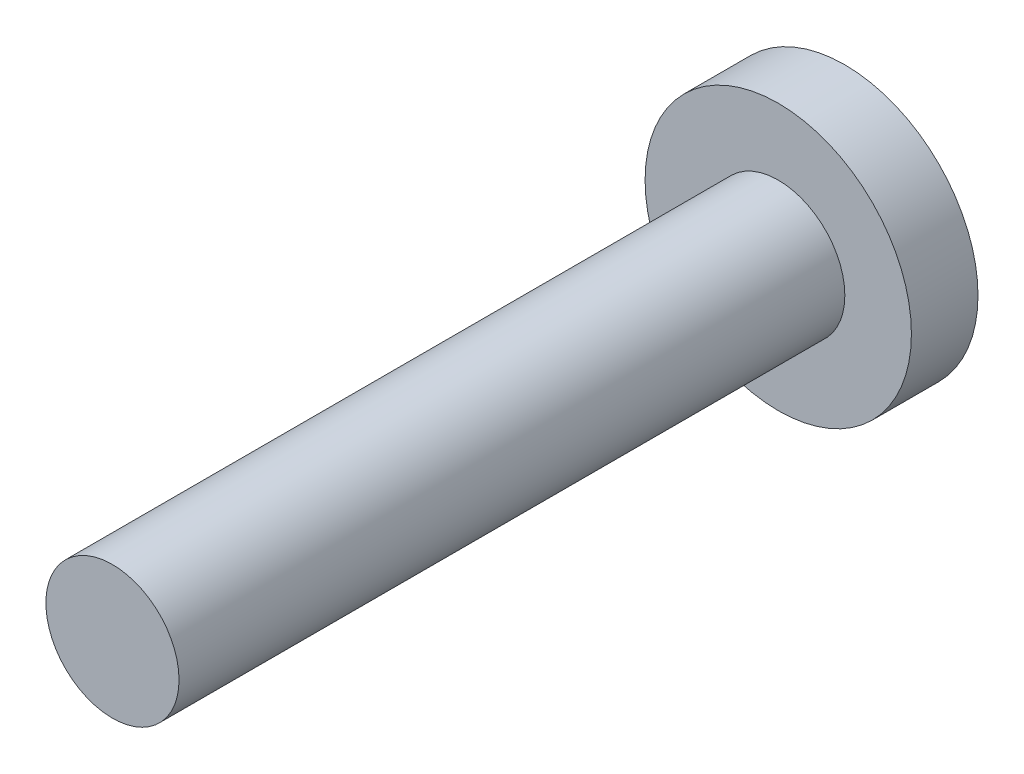
from build123d import *

# Parameters (mm, degrees)
SKETCH1_R           = 5
BOSS_EXTRUDE1_DEPTH = 2.5
SKETCH2_R           = 2.5
BOSS_EXTRUDE2_DEPTH = 25


with BuildPart() as part:
    # Sketch1 → Boss-Extrude1 (new body)
    with BuildSketch(Plane.XY):
        Circle(SKETCH1_R)
    extrude(amount=BOSS_EXTRUDE1_DEPTH)

    # Sketch2 → Boss-Extrude2 (add)
    with BuildSketch(Plane.XY.offset(2.5)):
        Circle(SKETCH2_R)
    extrude(amount=BOSS_EXTRUDE2_DEPTH)


solid = part.part
